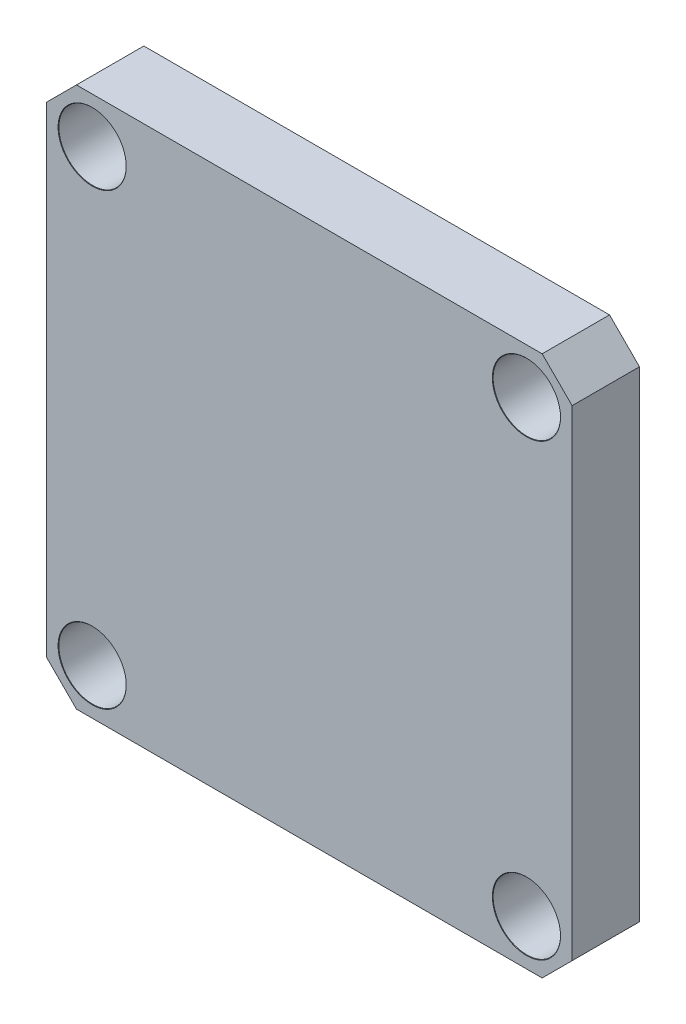
from build123d import *

# Parameters (mm, degrees)
SKETCH_1_W                  = 35.1
SKETCH_1_H                  = 36.1
EXTRUDE_1_DEPTH             = 4.5
CHAMFER_1_SIZE              = 2
HOLE_WIZARD_M41_D           = 4.5
HOLE_WIZARD_M41_CSINK_D     = 4.55
HOLE_WIZARD_M41_CSINK_ANGLE = 90


with BuildPart() as part:
    # Эскиз1 → Бобышка-Вытянуть1 (new body)
    with BuildSketch(Plane.XY):
        Rectangle(SKETCH_1_W, SKETCH_1_H)
    extrude(amount=EXTRUDE_1_DEPTH)

    # Фаска1
    chamfer_1_edges = [part.edges().sort_by_distance(p)[0] for p in [
        (17.55, -18.05, 2.25),
        (-17.55, -18.05, 2.25),
        (-17.55, 18.05, 2.25),
        (17.55, 18.05, 2.25),
    ]]
    chamfer(chamfer_1_edges, length=CHAMFER_1_SIZE)

    # Отверстие с зазором M41 (through all)
    with Locations(Plane(origin=(-14.5, 15, 4.5), x_dir=(1, 0, 0), z_dir=(0, 0, 1))):
        with Locations((0, 0), (29, 0), (29, -30), (0, -30)):
            CounterSinkHole(HOLE_WIZARD_M41_D / 2, HOLE_WIZARD_M41_CSINK_D / 2, counter_sink_angle=HOLE_WIZARD_M41_CSINK_ANGLE)


solid = part.part
